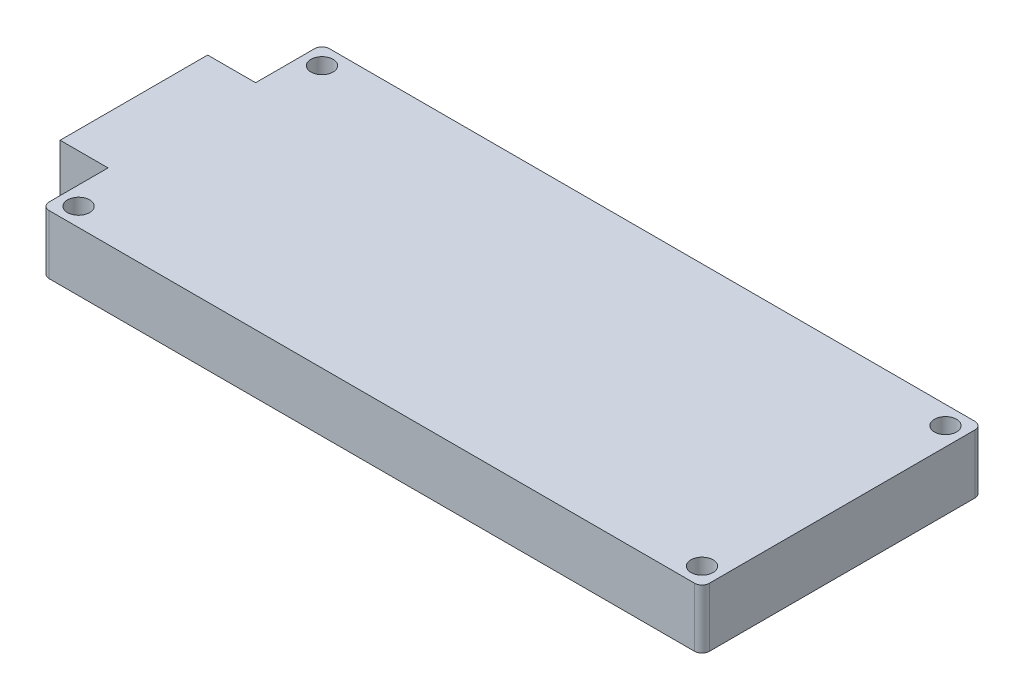
from build123d import *

# Parameters (mm, degrees)
SKETCH1_W           = 89.5
SKETCH1_H           = 38
BOSS_EXTRUDE1_DEPTH = 8
SKETCH2_R           = 1.5
CUT_EXTRUDE1_DEPTH  = 50.270300385
FILLET1_R           = 1
SKETCH4_W           = 6.5
SKETCH4_H           = 20
BOSS_EXTRUDE2_DEPTH = 8


with BuildPart() as part:
    # Sketch1 → Boss-Extrude1 (new body)
    with BuildSketch(Plane(origin=(0, 0, 0), x_dir=(1, 0, 0), z_dir=(0, 1, 0))):
        Rectangle(SKETCH1_W, SKETCH1_H)
    extrude(amount=BOSS_EXTRUDE1_DEPTH)

    # Sketch2 → Cut-Extrude1 (cut, through all)
    with BuildSketch(Plane(origin=(0, 8, 0), x_dir=(1, 0, 0), z_dir=(0, 1, 0))):
        with Locations(Location((-42.25, 16.5, 0), (0, 0, 270))):
            Circle(SKETCH2_R)
        with Locations(Location((42.25, 16.5, 0), (0, 0, 270))):
            Circle(SKETCH2_R)
        with Locations(Location((42.25, -16.5, 0), (0, 0, 270))):
            Circle(SKETCH2_R)
        with Locations(Location((-42.25, -16.5, 0), (0, 0, 270))):
            Circle(SKETCH2_R)
    extrude(amount=-CUT_EXTRUDE1_DEPTH, mode=Mode.SUBTRACT)

    # Fillet1
    fillet1_edges = [part.edges().sort_by_distance(p)[0] for p in [
        (44.75, 4, 19),
        (-44.75, 4, 19),
        (-44.75, 4, -19),
        (44.75, 4, -19),
    ]]
    fillet(fillet1_edges, radius=FILLET1_R)

    # Sketch4 → Boss-Extrude2 (add)
    with BuildSketch(Plane(origin=(0, 8, 0), x_dir=(1, 0, 0), z_dir=(0, 1, 0))):
        with Locations((-48, 0)):
            Rectangle(SKETCH4_W, SKETCH4_H)
    extrude(amount=-BOSS_EXTRUDE2_DEPTH)


solid = part.part
